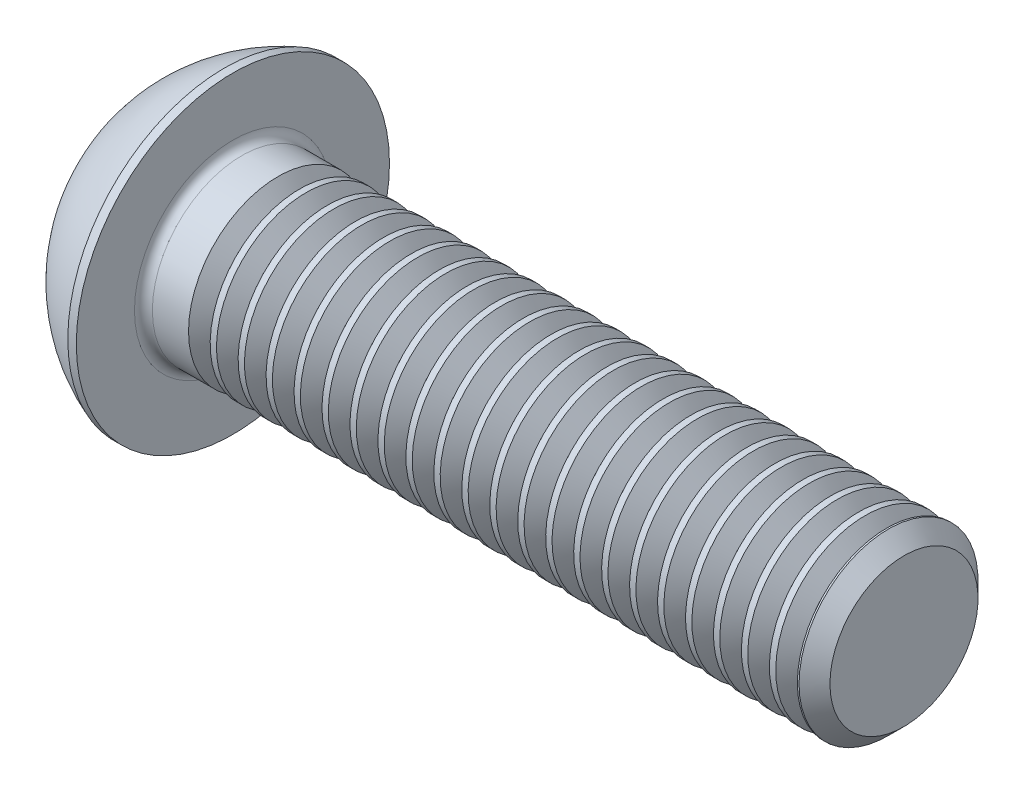
from build123d import *

# Parameters (mm, degrees)
FILLET1_R       = 0.4
HEX_2_DEPTH     = 2.6
THDSCHPAT_COUNT = 22
THDSCHPAT_PITCH = 1.25


with BuildPart() as part:
    # BodySke → BaseBody (revolve)
    with BuildSketch(Plane.XY, mode=Mode.PRIVATE) as basebody_sk:
        with BuildLine():
            Line((34.4, 0), (34.4, 3.3095))
            Line((34.4, 3.3095), (33.7095, 4))
            Line((33.7095, 4), (4.4, 4))
            Line((4.4, 4), (4.4, 7))
            Line((4.4, 7), (4.02, 7))
            ThreePointArc((4.02, 7), (1.686451133, 5.621618984), (0, 3.5))
            Line((0, 3.5), (0, 0))
            Line((0, 0), (34.4, 0))
        make_face()
    revolve(basebody_sk.sketch.rotate(Axis((0, 0, 0), (1, 0, 0)), 90), axis=Axis((0, 0, 0), (1, 0, 0)))

    # Fillet1
    fillet1_edges = [part.edges().sort_by_distance(p)[0] for p in [
        (4.4, 0, -4),
    ]]
    fillet(fillet1_edges, radius=FILLET1_R)

    # Sketch2 → PreBroach (revolve, cut)
    with BuildSketch(Plane.XY, mode=Mode.PRIVATE) as prebroach_sk:
        Polygon((0, 2.5), (2.6, 2.5), (4.043375673, 0), (0, 0), align=None)
    revolve(prebroach_sk.sketch.rotate(Axis((0, 0, 0), (1, 0, 0)), 90), axis=Axis((0, 0, 0), (1, 0, 0)), mode=Mode.SUBTRACT)

    # Sketch3 → Hex 2 (cut)
    with BuildSketch(Plane(origin=(0, 0, 0), x_dir=(0, 0, -1), z_dir=(1, 0, 0))):
        Polygon((-2.5, -1.443375673), (-2.5, 1.443375673), (0, 2.886751346), (2.5, 1.443375673), (2.5, -1.443375673), (0, -2.886751346), align=None)
    extrude(amount=HEX_2_DEPTH, mode=Mode.SUBTRACT)

    # ThdSchSke → ThreadSchematic (revolve, cut)
    with BuildSketch(Plane.XY, mode=Mode.PRIVATE) as threadschematic_sk:
        Polygon((6.9, -3.3095), (6.416506695, -4), (6.416506695, -5), (7.383493305, -5), (7.383493305, -4), align=None)
    threadschematic = revolve(threadschematic_sk.sketch.rotate(Axis((-3.175, 0, 0), (1, 0, 0)), 270), axis=Axis((-3.175, 0, 0), (1, 0, 0)), mode=Mode.SUBTRACT)

    # ThdSchPat: ThreadSchematic ×22
    with Locations(*[(i * THDSCHPAT_PITCH, 0, 0) for i in range(1, THDSCHPAT_COUNT)]):
        add(threadschematic, mode=Mode.SUBTRACT)


solid = part.part
